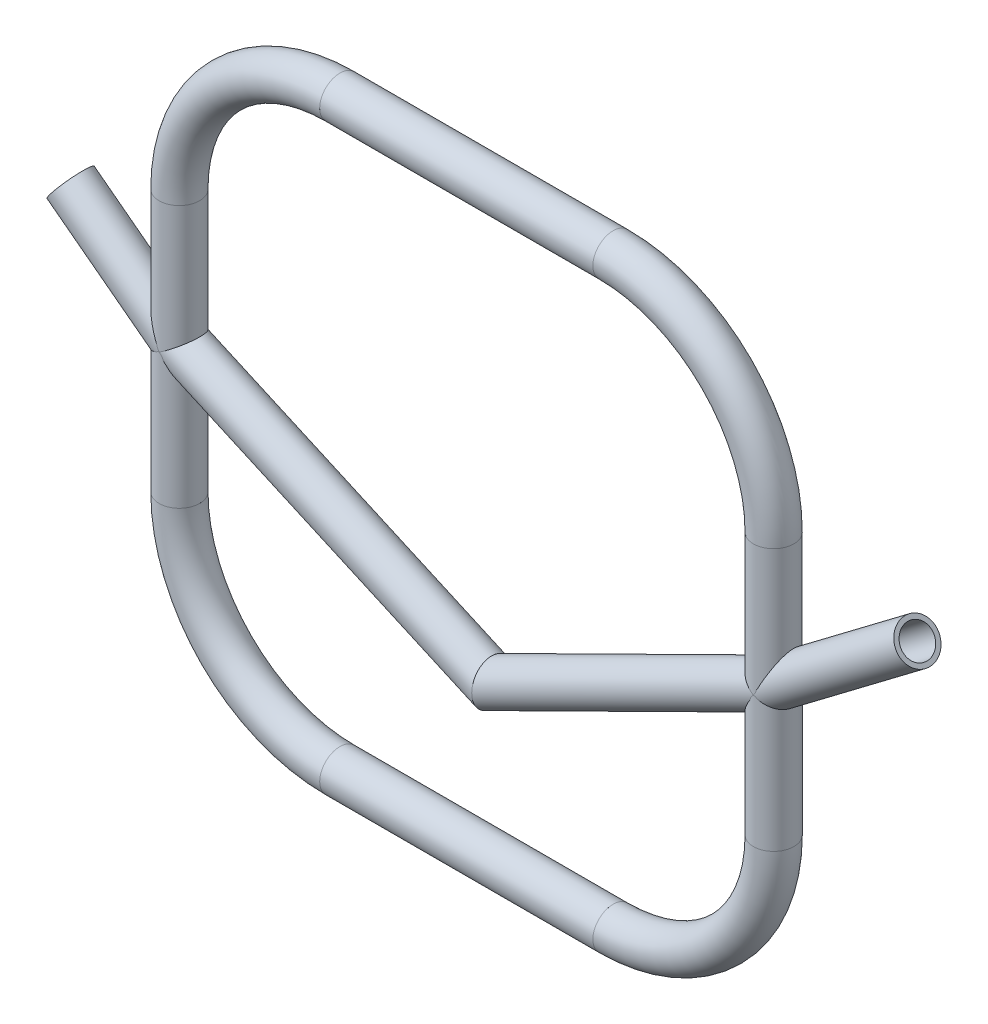
from build123d import *

# Parameters (mm, degrees)
SKETCH17_R                          = 3.175
SKETCH17_R_2                        = 2.4638
WELD_TUBING_0_250_X_0_028_1_DEPTH   = 41.117458539
SKETCH17_ON_SEGMENT_2_R             = 3.175
SKETCH17_ON_SEGMENT_2_R_2           = 2.4638
WELD_TUBING_0_250_X_0_028_1_2_ANGLE = 90
SKETCH17_ON_SEGMENT_3_R             = 3.175
SKETCH17_ON_SEGMENT_3_R_2           = 2.4638
WELD_TUBING_0_250_X_0_028_1_3_DEPTH = 42.843612898
SKETCH17_ON_SEGMENT_4_R             = 3.175
SKETCH17_ON_SEGMENT_4_R_2           = 2.4638
WELD_TUBING_0_250_X_0_028_1_4_ANGLE = 90
SKETCH17_ON_SEGMENT_5_R             = 3.175
SKETCH17_ON_SEGMENT_5_R_2           = 2.4638
WELD_TUBING_0_250_X_0_028_1_5_DEPTH = 41.117458539
SKETCH17_ON_SEGMENT_6_R             = 3.175
SKETCH17_ON_SEGMENT_6_R_2           = 2.4638
WELD_TUBING_0_250_X_0_028_1_6_ANGLE = 90
SKETCH17_ON_SEGMENT_7_R             = 3.175
SKETCH17_ON_SEGMENT_7_R_2           = 2.4638
WELD_TUBING_0_250_X_0_028_1_7_DEPTH = 42.843612898
SKETCH17_ON_SEGMENT_8_R             = 3.175
SKETCH17_ON_SEGMENT_8_R_2           = 2.4638
WELD_TUBING_0_250_X_0_028_1_8_ANGLE = 90
SKETCH18_R                          = 3.175
SKETCH18_R_2                        = 2.4638
WELD_TUBING_0_250_X_0_028_2_DEPTH   = 29.676469468
SKETCH18_ON_SEGMENT_2_R             = 3.175
SKETCH18_ON_SEGMENT_2_R_2           = 2.4638
WELD_TUBING_0_250_X_0_028_2_2_DEPTH = 53.837499631
SKETCH18_ON_SEGMENT_3_R             = 3.175
SKETCH18_ON_SEGMENT_3_R_2           = 2.4638
WELD_TUBING_0_250_X_0_028_2_3_DEPTH = 58.321452548
SKETCH18_ON_SEGMENT_4_R             = 3.175
SKETCH18_ON_SEGMENT_4_R_2           = 2.4638
WELD_TUBING_0_250_X_0_028_2_4_DEPTH = 22.93440718


with BuildPart() as part:
    # Sketch17 → Weld tubing 0.250 X 0.028(1) (new body)
    with BuildSketch(Plane(origin=(-46.606167695, 20.55872927, 0), x_dir=(1, 0, 0), z_dir=(0, -1, 0))):
        Circle(SKETCH17_R)
        Circle(SKETCH17_R_2, mode=Mode.SUBTRACT)
    extrude(amount=WELD_TUBING_0_250_X_0_028_1_DEPTH)


with BuildPart() as body_2:
    # Sketch17 on segment 2 (carried to the start of arc 2) → Weld tubing 0.250 X 0.028_1 2 (revolve)
    with BuildSketch(Plane(origin=(-46.606167695, -20.55872927, 0), x_dir=(1, 0, 0), z_dir=(0, -1, 0))):
        Circle(SKETCH17_ON_SEGMENT_2_R)
        Circle(SKETCH17_ON_SEGMENT_2_R_2, mode=Mode.SUBTRACT)
    revolve(axis=Axis((-21.421806449, -20.55872927, 0), (0, 0, 1)), revolution_arc=WELD_TUBING_0_250_X_0_028_1_2_ANGLE)


with BuildPart() as body_3:
    # Sketch17 on segment 3 (carried to segment 3) → Weld tubing 0.250 X 0.028_1 3 (new body)
    with BuildSketch(Plane(origin=(-21.421806449, -45.743090515, 0), x_dir=(0, 1, 0), z_dir=(1, 0, 0))):
        Circle(SKETCH17_ON_SEGMENT_3_R)
        Circle(SKETCH17_ON_SEGMENT_3_R_2, mode=Mode.SUBTRACT)
    extrude(amount=WELD_TUBING_0_250_X_0_028_1_3_DEPTH)


with BuildPart() as body_4:
    # Sketch17 on segment 4 (carried to the start of arc 4) → Weld tubing 0.250 X 0.028_1 4 (revolve)
    with BuildSketch(Plane(origin=(46.606167695, -20.55872927, 0), x_dir=(1, 0, 0), z_dir=(0, -1, 0))):
        Circle(SKETCH17_ON_SEGMENT_4_R)
        Circle(SKETCH17_ON_SEGMENT_4_R_2, mode=Mode.SUBTRACT)
    revolve(axis=Axis((21.421806449, -20.55872927, 0), (0, 0, -1)), revolution_arc=WELD_TUBING_0_250_X_0_028_1_4_ANGLE)


with BuildPart() as body_5:
    # Sketch17 on segment 5 (carried to segment 5) → Weld tubing 0.250 X 0.028_1 5 (new body)
    with BuildSketch(Plane(origin=(46.606167695, 20.55872927, 0), x_dir=(1, 0, 0), z_dir=(0, -1, 0))):
        Circle(SKETCH17_ON_SEGMENT_5_R)
        Circle(SKETCH17_ON_SEGMENT_5_R_2, mode=Mode.SUBTRACT)
    extrude(amount=WELD_TUBING_0_250_X_0_028_1_5_DEPTH)


with BuildPart() as body_6:
    # Sketch17 on segment 6 (carried to the start of arc 6) → Weld tubing 0.250 X 0.028_1 6 (revolve)
    with BuildSketch(Plane(origin=(46.606167695, 20.55872927, 0), x_dir=(-1, 0, 0), z_dir=(0, 1, 0))):
        Circle(SKETCH17_ON_SEGMENT_6_R)
        Circle(SKETCH17_ON_SEGMENT_6_R_2, mode=Mode.SUBTRACT)
    revolve(axis=Axis((21.421806449, 20.55872927, 0), (0, 0, 1)), revolution_arc=WELD_TUBING_0_250_X_0_028_1_6_ANGLE)


with BuildPart() as body_7:
    # Sketch17 on segment 7 (carried to segment 7) → Weld tubing 0.250 X 0.028_1 7 (new body)
    with BuildSketch(Plane(origin=(-21.421806449, 45.743090515, 0), x_dir=(0, 1, 0), z_dir=(1, 0, 0))):
        Circle(SKETCH17_ON_SEGMENT_7_R)
        Circle(SKETCH17_ON_SEGMENT_7_R_2, mode=Mode.SUBTRACT)
    extrude(amount=WELD_TUBING_0_250_X_0_028_1_7_DEPTH)


with BuildPart() as body_8:
    # Sketch17 on segment 8 (carried to the start of arc 8) → Weld tubing 0.250 X 0.028_1 8 (revolve)
    with BuildSketch(Plane(origin=(-46.606167695, 20.55872927, 0), x_dir=(-1, 0, 0), z_dir=(0, 1, 0))):
        Circle(SKETCH17_ON_SEGMENT_8_R)
        Circle(SKETCH17_ON_SEGMENT_8_R_2, mode=Mode.SUBTRACT)
    revolve(axis=Axis((-21.421806449, 20.55872927, 0), (0, 0, -1)), revolution_arc=WELD_TUBING_0_250_X_0_028_1_8_ANGLE)


with BuildPart() as body_9:
    # Sketch18 → Weld tubing 0.250 X 0.028(2) (new body)
    with BuildSketch(Plane(origin=(69.150362698, 17.032423285, 0), x_dir=(0.6028112684900666, -0.7978838102013329, 0), z_dir=(-0.797883810201333, -0.6028112684900667, 0))):
        Circle(SKETCH18_R)
        Circle(SKETCH18_R_2, mode=Mode.SUBTRACT)
    extrude(amount=WELD_TUBING_0_250_X_0_028_2_DEPTH)

    # Weld tubing 0.250 X 0.028(2) mitre 1
    split(bisect_by=Plane(origin=(46.606167695, 0, 0), x_dir=(-0.525604001, 0.850729354, 0), z_dir=(0.850729354, 0.525604001, 0)), keep=Keep.TOP)

    # Trim/Extend3: cut back where it meets the other member's skin (coped)
    split(bisect_by=body_5.part.faces().sort_by_distance((43.431167695, 1e-09, 0))[0], keep=Keep.TOP)


with BuildPart() as body_10:
    # Sketch18 on segment 2 (carried to segment 2) → Weld tubing 0.250 X 0.028_2 2 (new body)
    with BuildSketch(Plane(origin=(47.879999742, 0.630848882, 0), x_dir=(0.443795799, -0.896127942, 0), z_dir=(-0.896127942, -0.443795799, 0))):
        Circle(SKETCH18_ON_SEGMENT_2_R)
        Circle(SKETCH18_ON_SEGMENT_2_R_2, mode=Mode.SUBTRACT)
    extrude(amount=WELD_TUBING_0_250_X_0_028_2_2_DEPTH)

    # Weld tubing 0.250 X 0.028_2 2 mitre 1
    split(bisect_by=Plane(origin=(46.606167695, 0, 0), x_dir=(0.525604001, -0.850729354, 0), z_dir=(-0.850729354, -0.525604001, 0)), keep=Keep.TOP)

    # Weld tubing 0.250 X 0.028_2 2 mitre 2
    split(bisect_by=Plane(origin=(2.424090205, -21.880603695, 0), x_dir=(-0.02004091, 0.999799161, 0), z_dir=(0.999799161, 0.02004091, 0)), keep=Keep.TOP)

    # Trim/Extend3: cut back where it meets the other member's skin (coped)
    split(bisect_by=body_5.part.faces().sort_by_distance((43.431167695, 1e-09, 0))[0], keep=Keep.TOP)


with BuildPart() as body_11:
    # Sketch18 on segment 3 (carried to segment 3) → Weld tubing 0.250 X 0.028_2 3 (new body)
    with BuildSketch(Plane(origin=(5.266585843, -23.149116716, 0), x_dir=(-0.407528083, -0.913192675, 0), z_dir=(-0.913192675, 0.407528083, 0))):
        Circle(SKETCH18_ON_SEGMENT_3_R)
        Circle(SKETCH18_ON_SEGMENT_3_R_2, mode=Mode.SUBTRACT)
    extrude(amount=WELD_TUBING_0_250_X_0_028_2_3_DEPTH)

    # Weld tubing 0.250 X 0.028_2 3 mitre 1
    split(bisect_by=Plane(origin=(2.424090205, -21.880603695, 0), x_dir=(0.02004091, -0.999799161, 0), z_dir=(-0.999799161, -0.02004091, 0)), keep=Keep.TOP)

    # Weld tubing 0.250 X 0.028_2 3 mitre 2
    split(bisect_by=Plane(origin=(-46.606167695, 0, 0), x_dir=(0.509445417, 0.860502973, 0), z_dir=(0.860502973, -0.509445417, 0)), keep=Keep.TOP)

    # Trim/Extend2: cut back where it meets the other member's skin (coped)
    split(bisect_by=part.part.faces().sort_by_distance((-49.781167695, 0, 0))[0], keep=Keep.TOP)


with BuildPart() as body_12:
    # Sketch18 on segment 4 (carried to segment 4) → Weld tubing 0.250 X 0.028_2 4 (new body)
    with BuildSketch(Plane(origin=(-45.397325634, -0.917698926, 0), x_dir=(-0.604656744, -0.796486172, 0), z_dir=(-0.796486172, 0.604656744, 0))):
        Circle(SKETCH18_ON_SEGMENT_4_R)
        Circle(SKETCH18_ON_SEGMENT_4_R_2, mode=Mode.SUBTRACT)
    extrude(amount=WELD_TUBING_0_250_X_0_028_2_4_DEPTH)

    # Weld tubing 0.250 X 0.028_2 4 mitre 1
    split(bisect_by=Plane(origin=(-46.606167695, 0, 0), x_dir=(-0.509445417, -0.860502973, 0), z_dir=(-0.860502973, 0.509445417, 0)), keep=Keep.TOP)

    # Trim/Extend2: cut back where it meets the other member's skin (coped)
    split(bisect_by=part.part.faces().sort_by_distance((-49.781167695, 0, 0))[0], keep=Keep.TOP)


solid = Compound([part.part, body_2.part, body_3.part, body_4.part, body_5.part, body_6.part, body_7.part, body_8.part, body_9.part, body_10.part, body_11.part, body_12.part])
